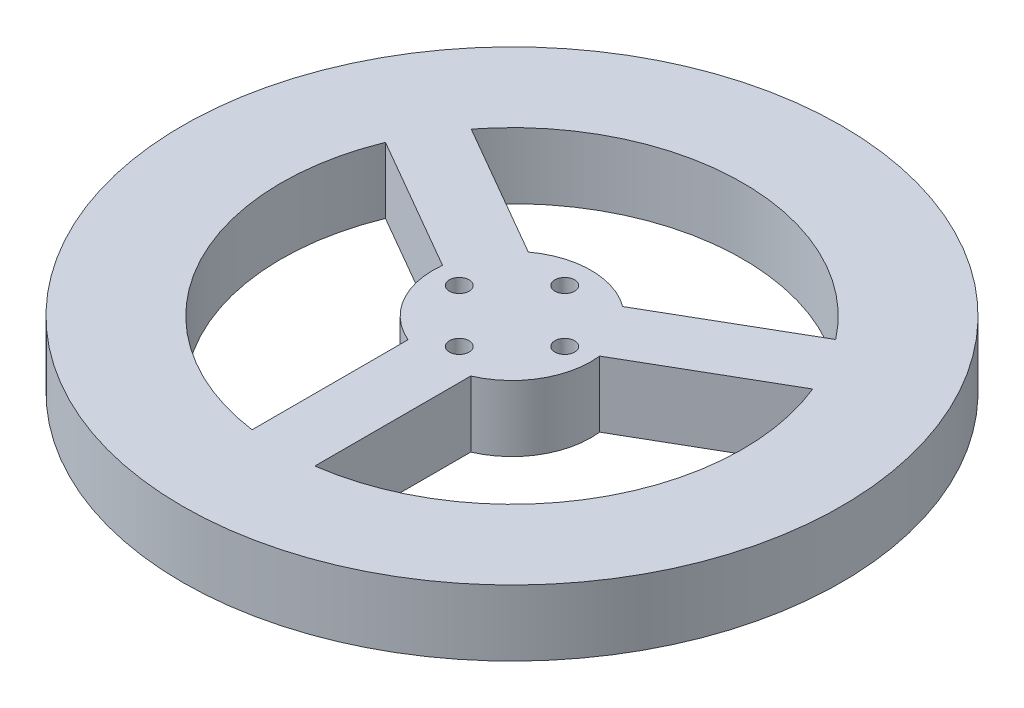
from build123d import *

# Parameters (mm, degrees)
SKETCH2_R           = 50
SKETCH2_R_2         = 35
SKETCH2_R_3         = 5.5
BOSS_EXTRUDE1_DEPTH = 10
SKETCH3_R           = 1.5
CUT_EXTRUDE1_DEPTH  = 5


with BuildPart() as part:
    # Sketch2 → Boss-Extrude1 (new body)
    # profile 1 of 11: a face of its own
    with BuildSketch(Plane(origin=(0, 0, 0), x_dir=(1, 0, 0), z_dir=(0, 1, 0))):
        with Locations(Location((0, 0, 0), (0, 0, 270))):
            Circle(SKETCH2_R)
        Circle(SKETCH2_R_2, mode=Mode.SUBTRACT)
    # profile 2 of 11: a face of its own
    with BuildSketch(Plane(origin=(0, 0, 0), x_dir=(1, 0, 0), z_dir=(0, 1, 0))):
        with BuildLine():
            ThreePointArc((-4.763139721, -2.75), (-4.763139721, 2.75), (0, 5.5))
            Line((0, 5.5), (-7.157003146, 9.632097693))
            ThreePointArc((-7.157003146, 9.632097693), (-10.392304845, 6), (-11.920142867, 1.382097693))
            Line((-11.920142867, 1.382097693), (-4.763139721, -2.75))
        make_face()
    # profile 3 of 11: a face of its own
    with BuildSketch(Plane(origin=(0, 0, 0), x_dir=(1, 0, 0), z_dir=(0, 1, 0))):
        with BuildLine():
            Line((-7.157003146, 9.632097693), (0, 5.5))
            Line((0, 5.5), (7.157003146, 9.632097693))
            ThreePointArc((7.157003146, 9.632097693), (0, 12), (-7.157003146, 9.632097693))
        make_face()
    # profile 4 of 11: a face of its own
    with BuildSketch(Plane(origin=(0, 0, 0), x_dir=(1, 0, 0), z_dir=(0, 1, 0))):
        with BuildLine():
            Line((7.157003146, 9.632097693), (0, 5.5))
            ThreePointArc((0, 5.5), (3.889087297, 3.889087297), (5.5, 0))
            ThreePointArc((5.5, 0), (5.312592045, -1.423504748), (4.763139721, -2.75))
            Line((4.763139721, -2.75), (11.920142867, 1.382097693))
            ThreePointArc((11.920142867, 1.382097693), (10.392304845, 6), (7.157003146, 9.632097693))
        make_face()
    # profile 5 of 11: a face of its own
    with BuildSketch(Plane(origin=(0, 0, 0), x_dir=(1, 0, 0), z_dir=(0, 1, 0))):
        with BuildLine():
            ThreePointArc((12, 0), (11.980019082, 0.692201415), (11.920142867, 1.382097693))
            Line((11.920142867, 1.382097693), (4.763139721, -2.75))
            Line((4.763139721, -2.75), (4.763139721, -11.014195386))
            ThreePointArc((4.763139721, -11.014195386), (10.028900155, -6.589473551), (12, 0))
        make_face()
    # profile 6 of 11: a face of its own
    with BuildSketch(Plane(origin=(0, 0, 0), x_dir=(1, 0, 0), z_dir=(0, 1, 0))):
        with BuildLine():
            ThreePointArc((4.763139721, -2.75), (0, -5.5), (-4.763139721, -2.75))
            Line((-4.763139721, -2.75), (-4.763139721, -11.014195386))
            ThreePointArc((-4.763139721, -11.014195386), (0, -12), (4.763139721, -11.014195386))
            Line((4.763139721, -11.014195386), (4.763139721, -2.75))
        make_face()
    # profile 7 of 11: a face of its own
    with BuildSketch(Plane(origin=(0, 0, 0), x_dir=(1, 0, 0), z_dir=(0, 1, 0))):
        with BuildLine():
            Line((-4.763139721, -11.014195386), (-4.763139721, -2.75))
            Line((-4.763139721, -2.75), (-11.920142867, 1.382097693))
            ThreePointArc((-11.920142867, 1.382097693), (-10.392304845, -6), (-4.763139721, -11.014195386))
        make_face()
    # profile 8 of 11: a face of its own
    with BuildSketch(Plane(origin=(0, 0, 0), x_dir=(1, 0, 0), z_dir=(0, 1, 0))):
        Circle(SKETCH2_R_3)
    # profile 9 of 11: a face of its own
    with BuildSketch(Plane(origin=(0, 0, 0), x_dir=(1, 0, 0), z_dir=(0, 1, 0))):
        with BuildLine():
            ThreePointArc((4.763139721, -11.014195386), (0, -12), (-4.763139721, -11.014195386))
            Line((-4.763139721, -11.014195386), (-4.763139721, -34.674378149))
            ThreePointArc((-4.763139721, -34.674378149), (0, -35), (4.763139721, -34.674378149))
            Line((4.763139721, -34.674378149), (4.763139721, -11.014195386))
        make_face()
    # profile 10 of 11: a face of its own
    with BuildSketch(Plane(origin=(0, 0, 0), x_dir=(1, 0, 0), z_dir=(0, 1, 0))):
        with BuildLine():
            ThreePointArc((-11.920142867, 1.382097693), (-10.392304845, 6), (-7.157003146, 9.632097693))
            Line((-7.157003146, 9.632097693), (-27.647322477, 21.462189074))
            ThreePointArc((-27.647322477, 21.462189074), (-30.310889132, 17.5), (-32.410462198, 13.212189074))
            Line((-32.410462198, 13.212189074), (-11.920142867, 1.382097693))
        make_face()
    # profile 11 of 11: a face of its own
    with BuildSketch(Plane(origin=(0, 0, 0), x_dir=(1, 0, 0), z_dir=(0, 1, 0))):
        with BuildLine():
            Line((27.647322477, 21.462189074), (7.157003146, 9.632097693))
            ThreePointArc((7.157003146, 9.632097693), (10.392304845, 6), (11.920142867, 1.382097693))
            Line((11.920142867, 1.382097693), (32.410462198, 13.212189074))
            ThreePointArc((32.410462198, 13.212189074), (30.310889132, 17.5), (27.647322477, 21.462189074))
        make_face()
    extrude(amount=BOSS_EXTRUDE1_DEPTH)

    # Sketch3 → Cut-Extrude1 (cut)
    with BuildSketch(Plane(origin=(0, 10, 0), x_dir=(1, 0, 0), z_dir=(0, 1, 0))):
        with Locations(Location((0, 8, 0), (0, 0, 270))):
            Circle(SKETCH3_R)
        with Locations(Location((8, 0, 0), (0, 0, 270))):
            Circle(SKETCH3_R)
        with Locations(Location((0, -8, 0), (0, 0, 270))):
            Circle(SKETCH3_R)
        with Locations(Location((-8, 0, 0), (0, 0, 270))):
            Circle(SKETCH3_R)
    extrude(amount=-CUT_EXTRUDE1_DEPTH, mode=Mode.SUBTRACT)


solid = part.part
